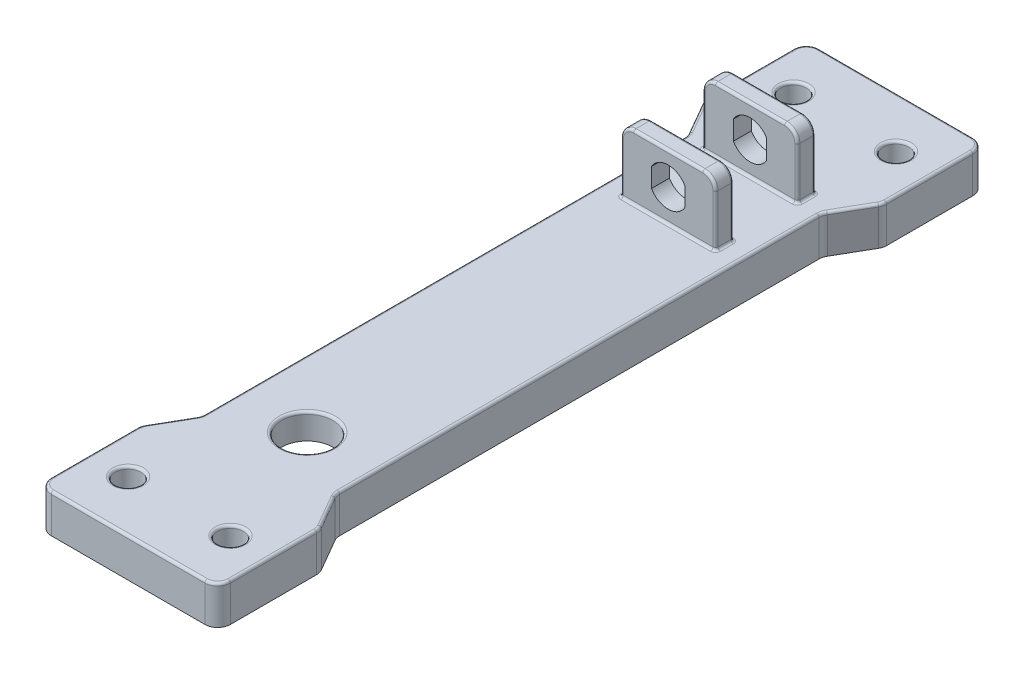
from build123d import *

# Parameters (mm, degrees)
BOSS_EXTRUDE1_DEPTH = 15
FILLET1_R           = 5
CUT_EXTRUDE1_DEPTH  = 5
SKETCH3_W           = 37
SKETCH3_H           = 7
BOSS_EXTRUDE2_DEPTH = 25
FILLET2_R           = 5
FILLET3_R           = 1
CUT_EXTRUDE2_DEPTH  = 216.339267204
SKETCH5_R           = 5
CUT_EXTRUDE3_DEPTH  = 157.044865343
SKETCH6_R           = 10
CUT_EXTRUDE4_DEPTH  = 157.044865343
FILLET4_R           = 1


with BuildPart() as part:
    # Sketch1 → Boss-Extrude1 (new body)
    with BuildSketch(Plane(origin=(0, 0, 0), x_dir=(1, 0, 0), z_dir=(0, 1, 0))):
        Polygon((-35, -150), (35, -150), (35, -110), (26.339745962, -95), (26.339745962, 95), (35, 110), (35, 150), (-35, 150), (-35, 110), (-26.339745962, 95), (-26.339745962, -95), (-35, -110), align=None)
    extrude(amount=-BOSS_EXTRUDE1_DEPTH)

    # Fillet1
    fillet1_edges = [part.edges().sort_by_distance(p)[0] for p in [
        (35, -7.5, -110),
        (26.339745962, -7.5, -95),
        (26.339745962, -7.5, 95),
        (35, -7.5, 110),
        (35, -7.5, 150),
        (-35, -7.5, 150),
        (-35, -7.5, 110),
        (-26.339745962, -7.5, 95),
        (-26.339745962, -7.5, -95),
        (-35, -7.5, -110),
        (-35, -7.5, -150),
        (35, -7.5, -150),
    ]]
    fillet(fillet1_edges, radius=FILLET1_R)

    # Sketch2 → Cut-Extrude1 (cut)
    with BuildSketch(Plane.XZ.offset(15)):
        with BuildLine():
            Line((-25, -140), (25, -140))
            Line((25, -140), (25, -112.679491924))
            Line((25, -112.679491924), (18.349364905, -101.160254038))
            ThreePointArc((18.349364905, -101.160254038), (16.850858568, -97.542539714), (16.339745962, -93.660254038))
            Line((16.339745962, -93.660254038), (16.339745962, 93.660254038))
            ThreePointArc((16.339745962, 93.660254038), (16.850858568, 97.542539714), (18.349364905, 101.160254038))
            Line((18.349364905, 101.160254038), (25, 112.679491924))
            Line((25, 112.679491924), (25, 140))
            Line((25, 140), (-25, 140))
            Line((-25, 140), (-25, 112.679491924))
            Line((-25, 112.679491924), (-18.349364905, 101.160254038))
            ThreePointArc((-18.349364905, 101.160254038), (-16.850858568, 97.542539714), (-16.339745962, 93.660254038))
            Line((-16.339745962, 93.660254038), (-16.339745962, -93.660254038))
            ThreePointArc((-16.339745962, -93.660254038), (-16.850858568, -97.542539714), (-18.349364905, -101.160254038))
            Line((-18.349364905, -101.160254038), (-25, -112.679491924))
            Line((-25, -112.679491924), (-25, -140))
        make_face()
    extrude(amount=-CUT_EXTRUDE1_DEPTH, mode=Mode.SUBTRACT)

    # Sketch3 → Boss-Extrude2 (add)
    with BuildSketch(Plane(origin=(0, 0, 0), x_dir=(1, 0, 0), z_dir=(0, 1, 0))):
        with Locations((0, 96.5)):
            Rectangle(SKETCH3_W, SKETCH3_H)
        with Locations((0, 64.5)):
            Rectangle(SKETCH3_W, SKETCH3_H)
    extrude(amount=BOSS_EXTRUDE2_DEPTH)

    # Fillet2
    fillet2_edges = [part.edges().sort_by_distance(p)[0] for p in [
        (18.5, 25, -96.5),
        (-18.5, 25, -96.5),
        (18.5, 25, -64.5),
        (-18.5, 25, -64.5),
    ]]
    fillet(fillet2_edges, radius=FILLET2_R)

    # Fillet3
    fillet3_edges = [part.edges().sort_by_distance(p)[0] for p in [
        (18.5, 0, -96.5),
        (0, 0, -100),
        (-18.5, 0, -96.5),
        (0, 0, -93),
        (18.5, 0, -64.5),
        (0, 0, -68),
        (-18.5, 0, -64.5),
        (0, 0, -61),
        (0, 25, -68),
        (0, 25, -61),
        (18.5, 10, -61),
        (-18.5, 10, -61),
        (17.035533906, 23.535533906, -61),
        (-17.035533906, 23.535533906, -61),
        (-18.5, 10, -68),
        (18.5, 10, -68),
        (17.035533906, 23.535533906, -68),
        (-17.035533906, 23.535533906, -68),
        (0, 25, -100),
        (0, 25, -93),
        (-18.5, 10, -100),
        (18.5, 10, -100),
        (-17.035533906, 23.535533906, -100),
        (17.035533906, 23.535533906, -100),
        (18.5, 10, -93),
        (-18.5, 10, -93),
        (-17.035533906, 23.535533906, -93),
        (17.035533906, 23.535533906, -93),
    ]]
    fillet(fillet3_edges, radius=FILLET3_R)

    # Sketch4 → Cut-Extrude2 (cut, through all)
    with BuildSketch(Plane.XY.offset(-61)):
        with BuildLine():
            Line((-6.5, 16.241657387), (-6.5, 8.758342613))
            ThreePointArc((-6.5, 8.758342613), (0, 5), (6.5, 8.758342613))
            Line((6.5, 8.758342613), (6.5, 16.241657387))
            ThreePointArc((6.5, 16.241657387), (0, 20), (-6.5, 16.241657387))
        make_face()
    extrude(amount=-CUT_EXTRUDE2_DEPTH, mode=Mode.SUBTRACT)

    # Sketch5 → Cut-Extrude3 (cut, through all)
    with BuildSketch(Plane(origin=(0, 0, 0), x_dir=(1, 0, 0), z_dir=(0, 1, 0))):
        with Locations(Location((-20, 130, 0), (0, 0, 270))):
            Circle(SKETCH5_R)
        with Locations(Location((20, 130, 0), (0, 0, 270))):
            Circle(SKETCH5_R)
        with Locations((20, -130)):
            Circle(SKETCH5_R)
        with Locations(Location((-20, -130, 0), (0, 0, 180))):
            Circle(SKETCH5_R)
    extrude(amount=-CUT_EXTRUDE3_DEPTH, mode=Mode.SUBTRACT)

    # Sketch6 → Cut-Extrude4 (cut, through all)
    with BuildSketch(Plane(origin=(0, 0, 0), x_dir=(1, 0, 0), z_dir=(0, 1, 0))):
        with Locations(Location((0, -80, 0), (0, 0, 270))):
            Circle(SKETCH6_R)
    extrude(amount=-CUT_EXTRUDE4_DEPTH, mode=Mode.SUBTRACT)

    # Fillet4
    fillet4_edges = [part.edges().sort_by_distance(p)[0] for p in [
        (-15, 0, 130),
        (15, 0, 130),
        (20, 0, -135),
        (-20, 0, -135),
        (35, 0, -128.169872981),
        (0, 0, 70),
        (0, 0, -150),
        (-35, 0, -128.169872981),
        (-30.669872981, 0, -102.5),
        (-26.339745962, 0, 0),
        (-30.669872981, 0, 102.5),
        (-35, 0, 128.169872981),
        (0, 0, 150),
        (35, 0, 128.169872981),
        (30.669872981, 0, 102.5),
        (26.339745962, 0, 0),
        (30.669872981, 0, -102.5),
        (33.535533906, 0, 148.535533906),
        (34.829629131, 0, -110.045650737),
        (34.829629131, 0, 110.045650737),
        (-33.535533906, 0, 148.535533906),
        (-34.829629131, 0, 110.045650737),
        (-34.829629131, 0, -110.045650737),
        (-33.535533906, 0, -148.535533906),
        (33.535533906, 0, -148.535533906),
        (-26.510116831, 0, -94.954349263),
        (-26.510116831, 0, 94.954349263),
        (26.510116831, 0, 94.954349263),
        (26.510116831, 0, -94.954349263),
    ]]
    fillet(fillet4_edges, radius=FILLET4_R)


solid = part.part
